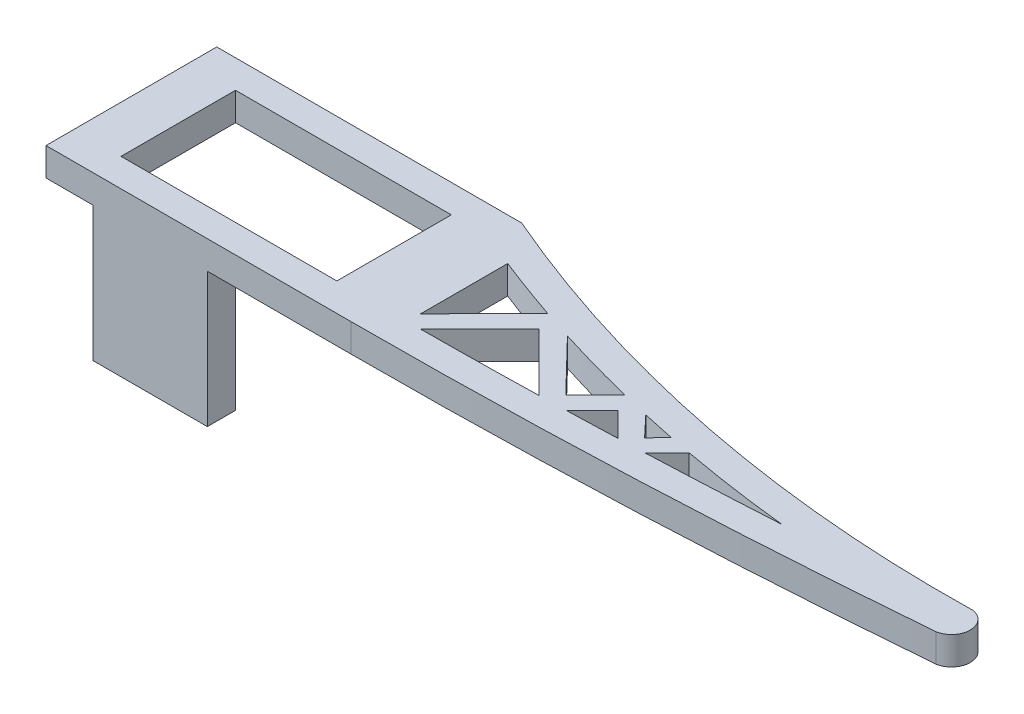
from build123d import *

# Parameters (mm, degrees)
SKETCH3_W           = 23
SKETCH3_H           = 12.2
BOSS_EXTRUDE1_DEPTH = 3
CUT_EXTRUDE1_DEPTH  = 79.334093387
SKETCH6_W           = 12.2
SKETCH6_H           = 3
BOSS_EXTRUDE2_DEPTH = 14.35


with BuildPart() as part:
    # Sketch3 → Boss-Extrude1 (new body)
    with BuildSketch(Plane(origin=(0, 0, 0), x_dir=(1, 0, 0), z_dir=(0, 1, 0))):
        with BuildLine():
            Line((-16.25, 9.2), (16.25, 9.2))
            ThreePointArc((16.25, 9.2), (45.532149663, 0.13158895), (76.073056463, -2.501542212))
            ThreePointArc((76.073056463, -2.501542212), (77.734099253, -4.472609946), (76.073056463, -6.443677679))
            ThreePointArc((76.073056463, -6.443677679), (46.188824578, -8.36062795), (16.25, -9))
            Line((16.25, -9), (-16.25, -9))
            Line((-16.25, -9), (-16.25, 9.2))
        make_face()
        with Locations((0.25, 0.1)):
            Rectangle(SKETCH3_W, SKETCH3_H, mode=Mode.SUBTRACT)
    extrude(amount=BOSS_EXTRUDE1_DEPTH)

    # Sketch5 → Cut-Extrude1 (cut, through all)
    with BuildSketch(Plane(origin=(0, 3, 0), x_dir=(1, 0, 0), z_dir=(0, 1, 0))):
        with BuildLine():
            Line((19.25, 4.714006378), (19.25, -4.579341889))
            Line((19.25, -4.579341889), (25.977749381, 2.242895118))
            ThreePointArc((25.977749381, 2.242895118), (22.598740451, 3.437246869), (19.25, 4.714006378))
        make_face()
        with BuildLine():
            Line((20.671769547, -5.985999467), (26.990590291, 0.332821278))
            Line((26.990590291, 0.332821278), (33.119603604, -5.796192035))
            ThreePointArc((33.119603604, -5.796192035), (26.896109589, -5.918837556), (20.671769547, -5.985999467))
        make_face()
        with BuildLine():
            Line((35.952850124, -5.721969404), (38.698754677, -2.976064852))
            Line((38.698754677, -2.976064852), (41.274144832, -5.551455007))
            ThreePointArc((41.274144832, -5.551455007), (38.613659992, -5.64178383), (35.952850124, -5.721969404))
        make_face()
        with BuildLine():
            Line((44.109524036, -5.444008267), (46.395047974, -3.086577857))
            ThreePointArc((46.395047974, -3.086577857), (52.157632807, -4.035426025), (57.95349503, -4.753533193))
            ThreePointArc((57.95349503, -4.753533193), (51.033222886, -5.133123327), (44.109524036, -5.444008267))
        make_face()
        with BuildLine():
            Line((29.11239722, 1.217185885), (34.499115549, -4.347276855))
            Line((34.499115549, -4.347276855), (37.58866149, -1.173111994))
            ThreePointArc((37.58866149, -1.173111994), (33.332539672, -0.041756487), (29.11239722, 1.217185885))
        make_face()
        with BuildLine():
            Line((40.562529295, -1.882957729), (42.638111064, -4.086994114))
            Line((42.638111064, -4.086994114), (44.022530764, -2.626821374))
            ThreePointArc((44.022530764, -2.626821374), (42.290280718, -2.265351983), (40.562529295, -1.882957729))
        make_face()
    extrude(amount=-CUT_EXTRUDE1_DEPTH, mode=Mode.SUBTRACT)

    # Sketch6 → Boss-Extrude2 (add)
    with BuildSketch(Plane.XZ):
        with Locations((-5.15, 7.5)):
            Rectangle(SKETCH6_W, SKETCH6_H)
    extrude(amount=BOSS_EXTRUDE2_DEPTH)


solid = part.part
